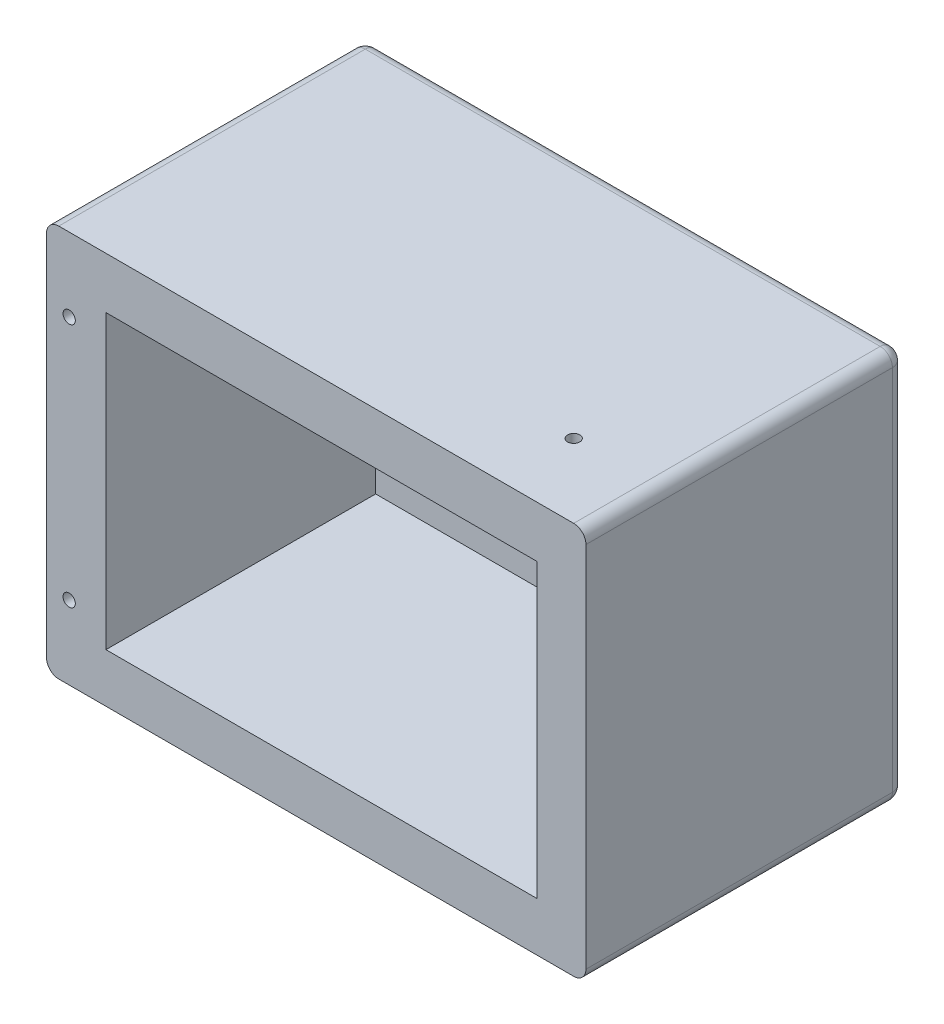
from build123d import *

# Parameters (mm, degrees)
SKETCH_1_W          = 440
SKETCH_1_H          = 320
EXTRUDE_1_DEPTH     = 260
SKETCH_6_W          = 351.529236831
SKETCH_6_H          = 238.132708821
CUT_EXTRUDE_1_DEPTH = 220
FILLET_1_R          = 10
SKETCH_7_R          = 5
CUT_EXTRUDE_2_DEPTH = 10
SKETCH_8_R          = 5
CUT_EXTRUDE_3_DEPTH = 10


with BuildPart() as part:
    # 草图1 → 凸台-拉伸1 (new body)
    with BuildSketch(Plane.XY):
        with Locations((220, -160)):
            Rectangle(SKETCH_1_W, SKETCH_1_H)
    extrude(amount=EXTRUDE_1_DEPTH)

    # 草图6 → 切除-拉伸1 (cut)
    with BuildSketch(Plane.XY.offset(260)):
        with Locations((224.235381585, -160.93364559)):
            Rectangle(SKETCH_6_W, SKETCH_6_H)
    extrude(amount=-CUT_EXTRUDE_1_DEPTH, mode=Mode.SUBTRACT)

    # 圆角1
    fillet_1_edges = [part.edges().sort_by_distance(p)[0] for p in [
        (220, 0, 0),
        (440, -160, 0),
        (220, -320, 0),
        (0, -160, 0),
        (0, 0, 130),
        (440, 0, 130),
        (440, -320, 130),
        (0, -320, 130),
    ]]
    fillet(fillet_1_edges, radius=FILLET_1_R)

    # 草图7 → 切除-拉伸2 (cut)
    with BuildSketch(Plane.XY.offset(260)):
        with Locations((18.470763169, -60)):
            Circle(SKETCH_7_R)
        with Locations((18.470763169, -260)):
            Circle(SKETCH_7_R)
    extrude(amount=-CUT_EXTRUDE_2_DEPTH, mode=Mode.SUBTRACT)

    # 草图8 → 切除-拉伸3 (cut)
    with BuildSketch(Plane(origin=(0, 0, 0), x_dir=(1, 0, 0), z_dir=(0, 1, 0))):
        with Locations(Location((370, -200, 0), (0, 0, 270))):
            Circle(SKETCH_8_R)
    extrude(amount=-CUT_EXTRUDE_3_DEPTH, mode=Mode.SUBTRACT)


solid = part.part
